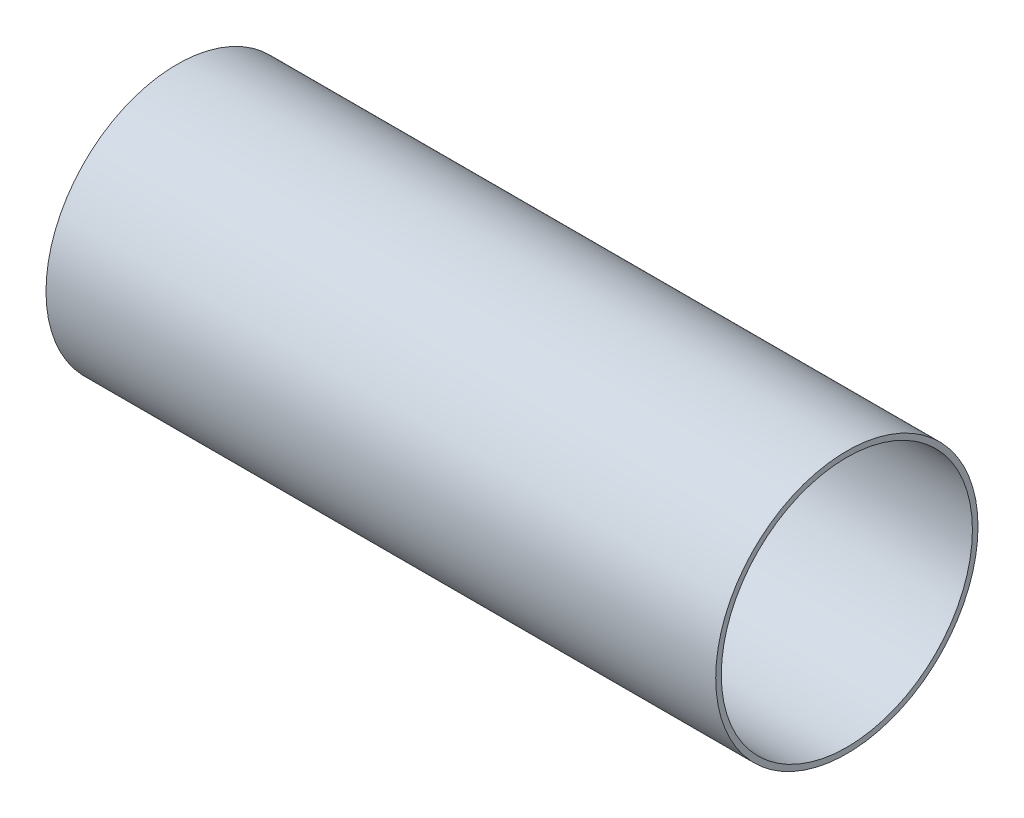
from build123d import *

# Parameters (mm, degrees)
SKETCH2_R           = 59.69
SKETCH2_R_2         = 57.15
EXTRUDE_THIN1_DEPTH = 304.8


with BuildPart() as part:
    # Sketch2 → Extrude-Thin1 (new body)
    with BuildSketch(Plane(origin=(0, 0, 0), x_dir=(0, 0, -1), z_dir=(1, 0, 0))):
        Circle(SKETCH2_R)
        Circle(SKETCH2_R_2, mode=Mode.SUBTRACT)
    extrude(amount=EXTRUDE_THIN1_DEPTH)


solid = part.part
